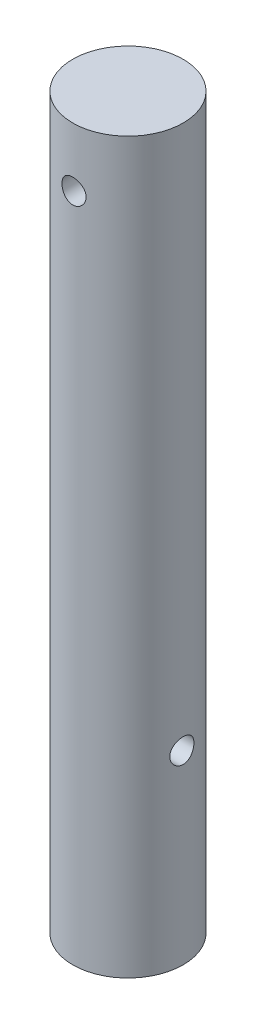
from build123d import *

# Parameters (mm, degrees)
SKETCH1_R                           = 4.7625
BOSS_EXTRUDE1_DEPTH                 = 9.525
SKETCH2_R                           = 4.7625
BOSS_EXTRUDE2_DEPTH                 = 53.34
CUT_EXTRUDE1_REACH                  = 65.225
CUT_EXTRUDE1_END_RADIUS             = 4.7625
SKETCH3_R                           = 1.0414
CUT_EXTRUDE1_DIRECTION_2_REACH      = 65.225
CUT_EXTRUDE1_DIRECTION_2_END_RADIUS = 4.7625
CUT_EXTRUDE2_REACH                  = 65.225
CUT_EXTRUDE2_END_RADIUS             = 4.7625
SKETCH4_R                           = 1.0414
CUT_EXTRUDE2_DIRECTION_2_REACH      = 65.225
CUT_EXTRUDE2_DIRECTION_2_END_RADIUS = 4.7625


with BuildPart() as part:
    # Sketch1 → Boss-Extrude1 (new body)
    with BuildSketch(Plane(origin=(0, 0, 0), x_dir=(1, 0, 0), z_dir=(0, 1, 0))):
        with Locations(Location((0, 0, 0), (0, 0, 270))):
            Circle(SKETCH1_R)
    extrude(amount=-BOSS_EXTRUDE1_DEPTH)

    # Sketch2 → Boss-Extrude2 (add)
    with BuildSketch(Plane(origin=(0, -9.525, 0), x_dir=(-1, 0, 0), z_dir=(0, -1, 0))):
        with Locations(Location((0, 0, 0), (0, 0, 270))):
            Circle(SKETCH2_R)
    extrude(amount=BOSS_EXTRUDE2_DEPTH)

    # Cut-Extrude1: up to this cylinder (the profile starts inside it)
    cut_extrude1_end = Plane(origin=(0, -5.08, 0), z_dir=(0, 1, 0)) * Cylinder(CUT_EXTRUDE1_END_RADIUS, 140.975, mode=Mode.PRIVATE)
    # Sketch3 → Cut-Extrude1 (cut, up to the surface)
    with BuildSketch(Plane.XY, mode=Mode.PRIVATE) as cut_extrude1_sk1:
        with Locations((0, -5.08)):
            Circle(SKETCH3_R)
    cut_extrude1_tool1 = extrude(cut_extrude1_sk1.sketch, amount=-CUT_EXTRUDE1_REACH, mode=Mode.PRIVATE) & cut_extrude1_end
    add(cut_extrude1_tool1.solids().sort_by_distance((0, -5.08, 0))[0], mode=Mode.SUBTRACT)

    # Cut-Extrude1 direction 2: up to this cylinder (the profile starts inside it)
    cut_extrude1_direction_2_end = Plane(origin=(0, -5.08, 0), z_dir=(0, 1, 0)) * Cylinder(CUT_EXTRUDE1_DIRECTION_2_END_RADIUS, 140.975, mode=Mode.PRIVATE)
    # Sketch3 → Cut-Extrude1 direction 2 (cut, up to the surface)
    with BuildSketch(Plane.XY, mode=Mode.PRIVATE) as cut_extrude1_direction_2_sk1:
        with Locations((0, -5.08)):
            Circle(SKETCH3_R)
    cut_extrude1_direction_2_tool1 = extrude(cut_extrude1_direction_2_sk1.sketch, amount=CUT_EXTRUDE1_DIRECTION_2_REACH, mode=Mode.PRIVATE) & cut_extrude1_direction_2_end
    add(cut_extrude1_direction_2_tool1.solids().sort_by_distance((0, -5.08, 0))[0], mode=Mode.SUBTRACT)

    # Cut-Extrude2: up to this cylinder (the profile starts inside it)
    cut_extrude2_end = Plane(origin=(0, -46.863, 0), z_dir=(0, 1, 0)) * Cylinder(CUT_EXTRUDE2_END_RADIUS, 140.975, mode=Mode.PRIVATE)
    # Sketch4 → Cut-Extrude2 (cut, up to the surface)
    with BuildSketch(Plane(origin=(0, 0, 0), x_dir=(0, 0, -1), z_dir=(1, 0, 0)), mode=Mode.PRIVATE) as cut_extrude2_sk1:
        with Locations((0, -46.863)):
            Circle(SKETCH4_R)
    cut_extrude2_tool1 = extrude(cut_extrude2_sk1.sketch, amount=-CUT_EXTRUDE2_REACH, mode=Mode.PRIVATE) & cut_extrude2_end
    add(cut_extrude2_tool1.solids().sort_by_distance((0, -46.863, 0))[0], mode=Mode.SUBTRACT)

    # Cut-Extrude2 direction 2: up to this cylinder (the profile starts inside it)
    cut_extrude2_direction_2_end = Plane(origin=(0, -46.863, 0), z_dir=(0, 1, 0)) * Cylinder(CUT_EXTRUDE2_DIRECTION_2_END_RADIUS, 140.975, mode=Mode.PRIVATE)
    # Sketch4 → Cut-Extrude2 direction 2 (cut, up to the surface)
    with BuildSketch(Plane(origin=(0, 0, 0), x_dir=(0, 0, -1), z_dir=(1, 0, 0)), mode=Mode.PRIVATE) as cut_extrude2_direction_2_sk1:
        with Locations((0, -46.863)):
            Circle(SKETCH4_R)
    cut_extrude2_direction_2_tool1 = extrude(cut_extrude2_direction_2_sk1.sketch, amount=CUT_EXTRUDE2_DIRECTION_2_REACH, mode=Mode.PRIVATE) & cut_extrude2_direction_2_end
    add(cut_extrude2_direction_2_tool1.solids().sort_by_distance((0, -46.863, 0))[0], mode=Mode.SUBTRACT)


solid = part.part
